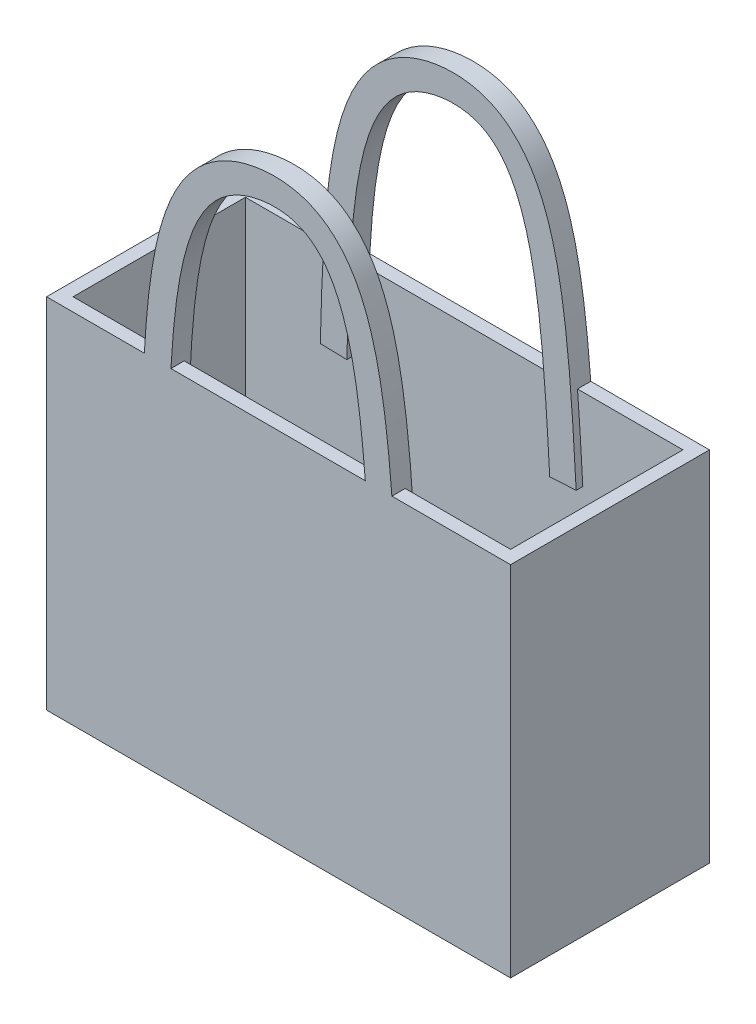
from build123d import *

# Parameters (mm, degrees)
SKETCH_2_W          = 350
SKETCH_2_H          = 270
EXTRUDE_1_DEPTH     = 150
SKETCH_4_W          = 330
SKETCH_4_H          = 130
CUT_EXTRUDE_1_DEPTH = 231
EXTRUDE_2_DEPTH     = 15


with BuildPart() as part:
    # 草图2 → 凸台-拉伸1 (new body)
    with BuildSketch(Plane.XY):
        with Locations((175, -135)):
            Rectangle(SKETCH_2_W, SKETCH_2_H)
    extrude(amount=EXTRUDE_1_DEPTH)

    # 草图4 → 切除-拉伸1 (cut)
    with BuildSketch(Plane(origin=(0, 0, 0), x_dir=(1, 0, 0), z_dir=(0, 1, 0))):
        with Locations((175, -75)):
            Rectangle(SKETCH_4_W, SKETCH_4_H)
    extrude(amount=-CUT_EXTRUDE_1_DEPTH, mode=Mode.SUBTRACT)

    # 草图5 → 凸台-拉伸2 (add)
    with BuildSketch(Plane.XY.offset(150)):
        with BuildLine():
            Line((71.499074755, -62.321951155), (91.49298091, -62.81562785))
            add(Edge.make_bspline(
                [(244.505619551, -62.81562785), (238.321506578, 48.056683318), (229.936112774, 149.875026184), (99.651245838, 140.581809832), (94.143315242, 44.522912596), (91.49298091, -62.81562785)],
                knots=[0, 0, 0, 0, 0.420288217, 0.520288217, 1, 1, 1, 1], degree=3))
            Line((244.505619551, -62.81562785), (264.474581337, -61.701821216))
            add(Edge.make_bspline(
                [(264.474581337, -61.701821216), (264.359861197, -59.645053001), (264.128171161, -55.518328146), (263.662584547, -47.371516931), (263.068669824, -37.318916279), (262.326073092, -25.498997381), (261.279307032, -10.069500952), (259.834076028, 8.568059805), (257.778866416, 29.817484178), (255.296076431, 49.881602338), (251.253957389, 74.977987758), (245.870456485, 97.500240079), (238.370187441, 117.374287672), (231.363192359, 130.930109167), (222.563205851, 142.99932037), (211.521242854, 153.164247974), (200.418602182, 159.355264747), (190.636952867, 162.586657438), (183.158869734, 164.088930656), (175.715503483, 164.788484604), (165.858150686, 164.786603225), (153.792320604, 163.213522241), (140.018348362, 159.056690805), (127.488531798, 152.648337794), (116.504391158, 144.203146271), (104.11740969, 130.714428634), (92.707895665, 110.654723235), (83.758959482, 82.873926583), (78.991737003, 56.78125762), (76.307319371, 34.202145736), (74.761097926, 16.439528143), (73.59001413, -2.121732197), (72.855633083, -18.224997981), (72.372109121, -31.469107314), (72.051523972, -41.576380624), (71.811085505, -50.143277189), (71.630081612, -57.072087241), (71.542204325, -60.575203576), (71.499074755, -62.321951155)],
                knots=[0, 0, 0, 0, 0.0078125, 0.015625, 0.03125, 0.046875, 0.0625, 0.09375, 0.125, 0.15625, 0.1875, 0.25, 0.28125, 0.3125, 0.34375, 0.375, 0.40625, 0.421875, 0.4375, 0.453125, 0.46875, 0.5, 0.53125, 0.5625, 0.59375, 0.625, 0.6875, 0.75, 0.8125, 0.84375, 0.875, 0.90625, 0.9375, 0.953125, 0.96875, 0.984375, 0.9921875, 1, 1, 1, 1], degree=3))
        make_face()
    extrude_2 = extrude(amount=-EXTRUDE_2_DEPTH)

    # 镜向1: 凸台-拉伸2 across plane
    add(extrude_2.mirror(Plane(origin=(0, 0, 75), x_dir=(1, 0, 0), z_dir=(0, 0, -1))))


solid = part.part
